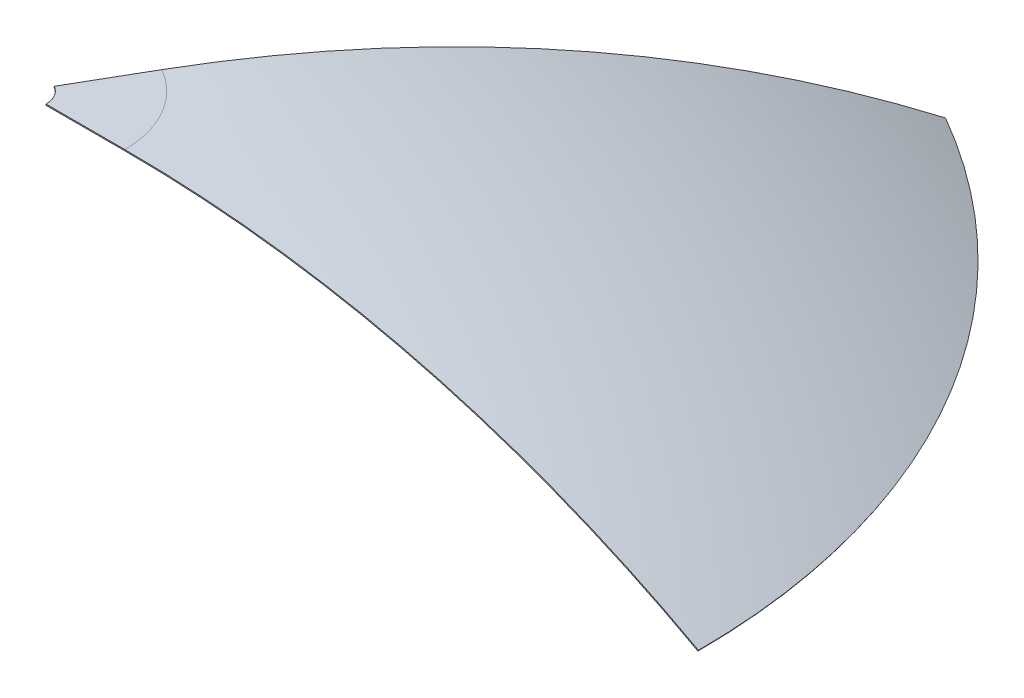
from build123d import *

# Parameters (mm, degrees)
REVOLVE1_ANGLE = 60


with BuildPart() as part:
    # Sketch1 → Revolve1 (revolve)
    with BuildSketch(Plane.XY):
        with BuildLine():
            Line((10, -0.5), (45, -0.5))
            ThreePointArc((45, -0.5), (45.500946005, -0.500236893), (46.001891561, -0.50094757))
            ThreePointArc((46.001891561, -0.50094757), (176.838494864, -17.170276226), (299.5, -65.649534053))
            Line((299.5, -65.649534053), (299.740246695, -65.211034879))
            ThreePointArc((299.740246695, -65.211034879), (176.962949727, -16.686012882), (46.002837341, -0.000948465))
            ThreePointArc((46.002837341, -0.000948465), (45.501418895, -0.000237116), (45, 0))
            Line((45, 0), (10, 0))
            Line((10, 0), (10, -0.5))
        make_face()
    revolve(axis=Axis((0, -1000, 0), (0, 1, 0)), revolution_arc=REVOLVE1_ANGLE)


solid = part.part
